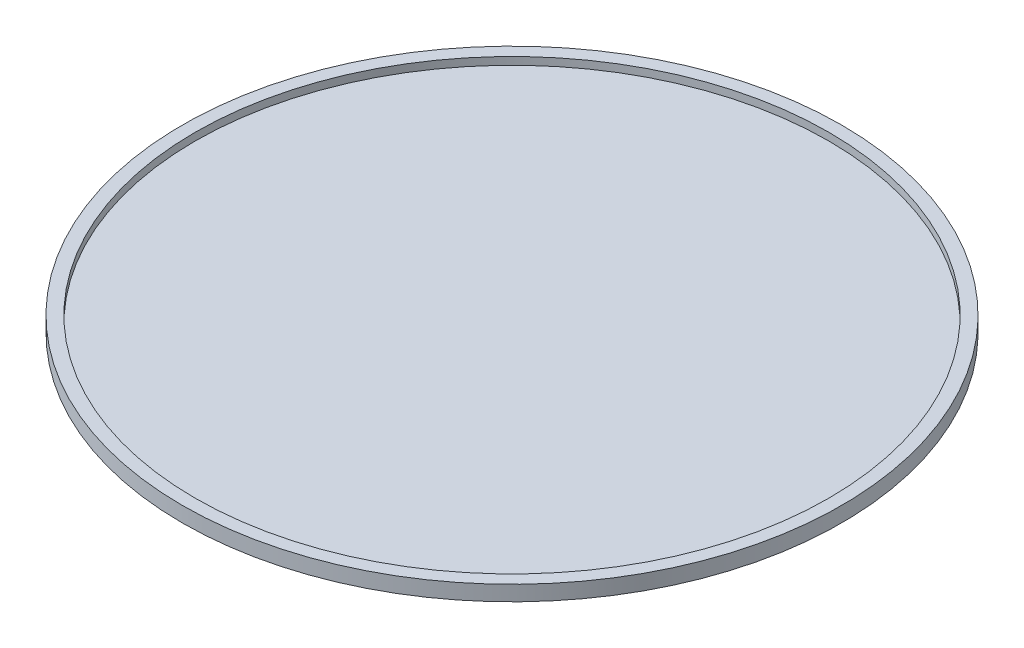
from build123d import *

# Parameters (mm, degrees)
SKETCH1_R                = 125
BOSS_EXTRUDE1_DEPTH      = 3
BOSS_EXTRUDE2_DEPTH      = 3
BOSS_EXTRUDE2_DEPTH_BACK = 3
SKETCH2_R                = 130
SKETCH2_R_2              = 125


with BuildPart() as part:
    # Sketch1 → Boss-Extrude1 (new body)
    with BuildSketch(Plane(origin=(0, 0, 0), x_dir=(1, 0, 0), z_dir=(0, 1, 0))):
        with Locations(Location((0, 0, 0), (0, 0, 270))):
            Circle(SKETCH1_R)
    extrude(amount=BOSS_EXTRUDE1_DEPTH)

    # Sketch2 → Boss-Extrude2 (add, two sides: drawn at the far end of the back side and taken through both)
    with BuildSketch(Plane(origin=(0, 3, 0), x_dir=(1, 0, 0), z_dir=(0, 1, 0)).offset(-BOSS_EXTRUDE2_DEPTH_BACK)):
        with Locations(Location((0, 0, 0), (0, 0, 270))):
            Circle(SKETCH2_R)
        with Locations(Location((0, 0, 0), (0, 0, 270))):
            Circle(SKETCH2_R_2, mode=Mode.SUBTRACT)
    extrude(amount=BOSS_EXTRUDE2_DEPTH + BOSS_EXTRUDE2_DEPTH_BACK)


solid = part.part
